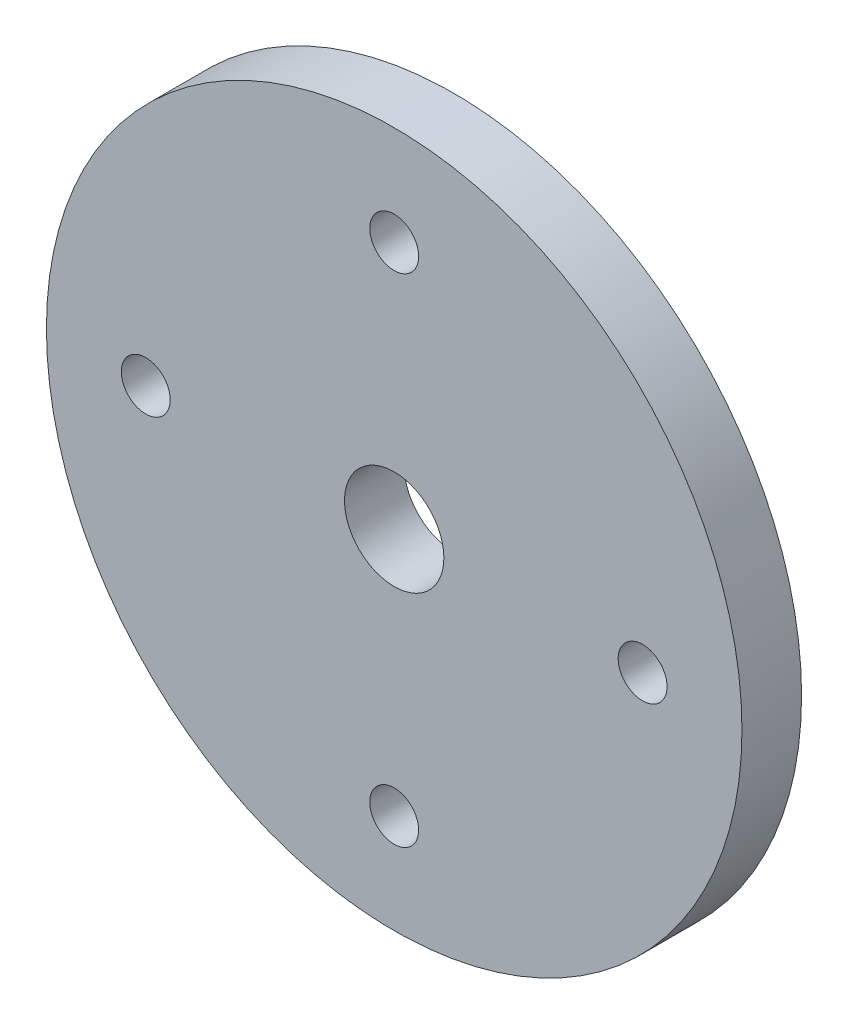
from build123d import *

# Parameters (mm, degrees)
SKETCH2_R           = 17.5
SKETCH2_R_2         = 2.5
SKETCH2_R_3         = 1.23
BOSS_EXTRUDE1_DEPTH = 3


with BuildPart() as part:
    # Sketch2 → Boss-Extrude1 (new body)
    with BuildSketch(Plane.XY):
        Circle(SKETCH2_R)
        Circle(SKETCH2_R_2, mode=Mode.SUBTRACT)
        with Locations((0, 12.5)):
            Circle(SKETCH2_R_3, mode=Mode.SUBTRACT)
        with Locations((12.5, 0)):
            Circle(SKETCH2_R_3, mode=Mode.SUBTRACT)
        with Locations((0, -12.5)):
            Circle(SKETCH2_R_3, mode=Mode.SUBTRACT)
        with Locations((-12.5, 0)):
            Circle(SKETCH2_R_3, mode=Mode.SUBTRACT)
    extrude(amount=BOSS_EXTRUDE1_DEPTH)


solid = part.part
